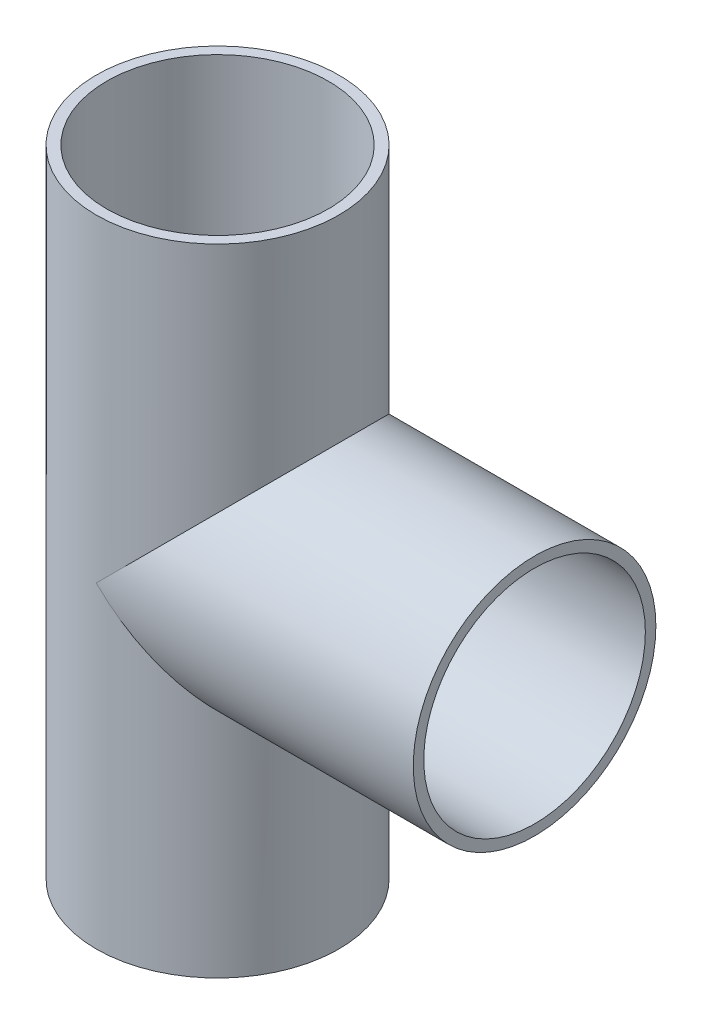
from build123d import *

# Parameters (mm, degrees)
EXTRUDE1_DEPTH          = 50.038
EXTRUDE1_DEPTH_BACK     = 49.784
SKETCH1_R               = 19.05
EXTRUDE2_REACH          = 89.206
EXTRUDE2_END_RADIUS     = 19.05
SKETCH3_R               = 19.05
SKETCH4_R               = 17.399
CUT_EXTRUDE1_DEPTH      = 49.784
CUT_EXTRUDE2_DEPTH      = 74.11053686
CUT_EXTRUDE2_DEPTH_BACK = 74.11053686
SKETCH5_R               = 17.399


with BuildPart() as part:
    # Sketch1 → Extrude1 (new, two sides: drawn at the far end of the back side and taken through both)
    with BuildSketch(Plane(origin=(0, 0, 0), x_dir=(1, 0, 0), z_dir=(0, 1, 0)).offset(-EXTRUDE1_DEPTH_BACK)):
        with Locations(Location((0, 0, 0), (0, 0, 270))):
            Circle(SKETCH1_R)
    extrude(amount=EXTRUDE1_DEPTH + EXTRUDE1_DEPTH_BACK)

    # Extrude2: up to this cylinder (the profile starts outside it)
    extrude2_end = Plane(origin=(0, 0, 0), z_dir=(0, 1, 0)) * Cylinder(EXTRUDE2_END_RADIUS, 217.512, mode=Mode.PRIVATE)
    # Sketch3 → Extrude2 (add, up to the surface)
    with BuildSketch(Plane(origin=(49.784, 0, 0), x_dir=(0, 0, -1), z_dir=(1, 0, 0)), mode=Mode.PRIVATE) as extrude2_sk1:
        Circle(SKETCH3_R)
    extrude2_tool1 = extrude(extrude2_sk1.sketch, amount=-EXTRUDE2_REACH, mode=Mode.PRIVATE) - extrude2_end
    add(extrude2_tool1.solids().sort_by_distance((49.784, 0, 0))[0])

    # Sketch4 → Cut-Extrude1 (cut)
    with BuildSketch(Plane(origin=(49.784, 0, 0), x_dir=(0, 0, -1), z_dir=(1, 0, 0))):
        Circle(SKETCH4_R)
    extrude(amount=-CUT_EXTRUDE1_DEPTH, mode=Mode.SUBTRACT)

    # Sketch5 → Cut-Extrude2 (cut, two sides: drawn at the far end of the back side and taken through both)
    with BuildSketch(Plane(origin=(0, 0, 0), x_dir=(1, 0, 0), z_dir=(0, 1, 0)).offset(-CUT_EXTRUDE2_DEPTH_BACK)):
        with Locations(Location((0, 0, 0), (0, 0, 270))):
            Circle(SKETCH5_R)
    extrude(amount=CUT_EXTRUDE2_DEPTH + CUT_EXTRUDE2_DEPTH_BACK, mode=Mode.SUBTRACT)


solid = part.part
